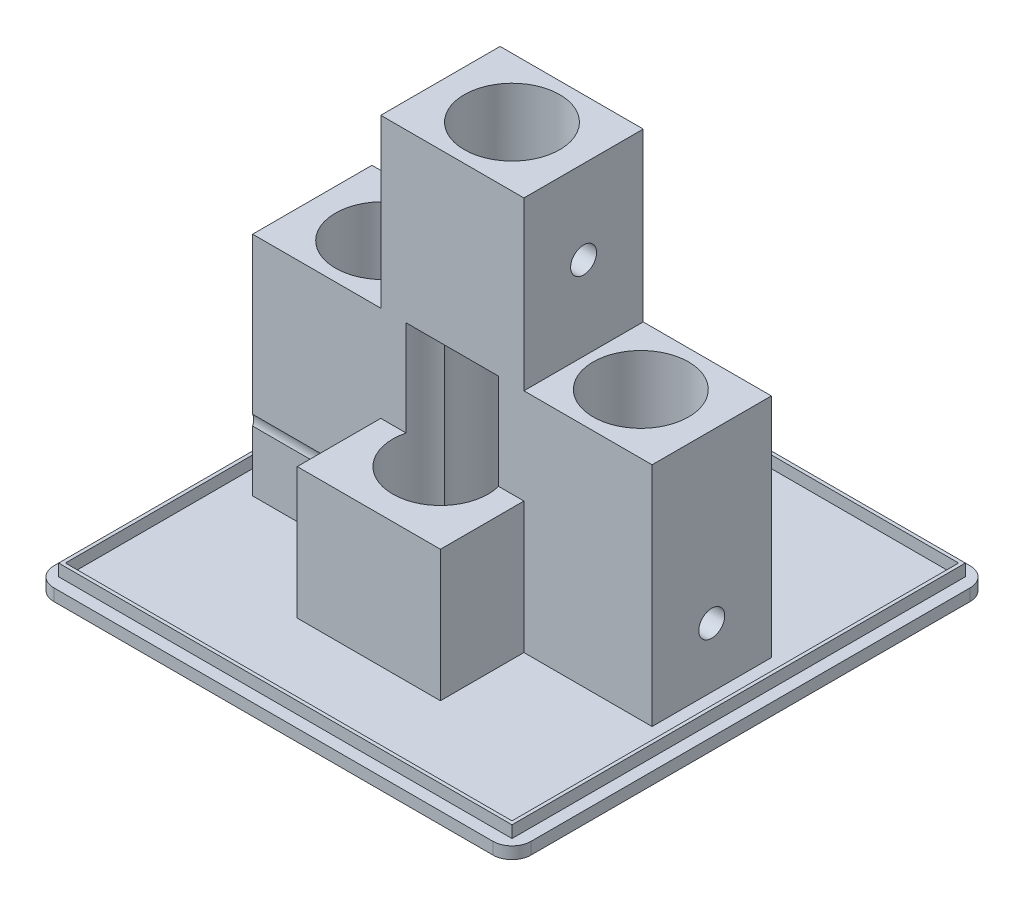
from build123d import *

# Parameters (mm, degrees)
SKETCH1_W                       = 19.05
SKETCH1_H                       = 19.05
BOSS_EXTRUDE1_DEPTH             = 38.1
SKETCH6_W                       = 19.05
SKETCH6_H                       = 15.875
BOSS_EXTRUDE3_DEPTH             = 34.925
SKETCH2_R                       = 6.35
CUT_EXTRUDE1_DEPTH              = 31.75
SKETCH8_R                       = 6.35
CUT_EXTRUDE4_DEPTH              = 67.750552432
SKETCH10_W                      = 17.05
SKETCH10_H                      = 15.875
BOSS_EXTRUDE4_DEPTH             = 31.75
SKETCH11_R                      = 6.35
CUT_EXTRUDE6_DEPTH              = 31.75
CUT_EXTRUDE7_REACH              = 70.78
CUT_EXTRUDE7_END_RADIUS         = 6.35
SKETCH12_R                      = 1.7272
SKETCH13_W                      = 63.5
SKETCH13_H                      = 63.5
BOSS_EXTRUDE5_DEPTH             = 1.5875
CUT_EXTRUDE9_REACH              = 81.121
CUT_EXTRUDE9_END_RADIUS         = 6.35
SKETCH15_R                      = 1.7272
SKETCH16_W                      = 60.325
SKETCH16_H                      = 60.325
SKETCH16_W_2                    = 59.425
SKETCH16_H_2                    = 59.425
BOSS_EXTRUDE6_DEPTH             = 1.5875
FILLET1_R                       = 2.54
CUT_EXTRUDE10_REACH             = 81.121
SKETCH18_R                      = 1.7272
CUT_EXTRUDE10_DIRECTION_2_DEPTH = 80.12059235


with BuildPart() as part:
    # Sketch1 → Boss-Extrude1 (new body)
    with BuildSketch(Plane.XY):
        Rectangle(SKETCH1_W, SKETCH1_H)
    extrude(amount=BOSS_EXTRUDE1_DEPTH)

    # Sketch6 → Boss-Extrude3 (add)
    with BuildSketch(Plane(origin=(0, 9.525, 0), x_dir=(1, 0, 0), z_dir=(0, 1, 0))):
        with Locations((0, -19.05)):
            Rectangle(SKETCH6_W, SKETCH6_H)
    extrude(amount=BOSS_EXTRUDE3_DEPTH)

    # Sketch2 → Cut-Extrude1 (cut)
    with BuildSketch(Plane(origin=(0, -9.525, 0), x_dir=(-1, 0, 0), z_dir=(0, -1, 0))):
        with Locations(Location((0, -28.575, 0), (0, 0, 90))):
            Circle(SKETCH2_R)
        with Locations(Location((0, -9.525, 0), (0, 0, 90))):
            Circle(SKETCH2_R)
    extrude(amount=-CUT_EXTRUDE1_DEPTH, mode=Mode.SUBTRACT)

    # Sketch8 → Cut-Extrude4 (cut, through all)
    with BuildSketch(Plane(origin=(0, 44.45, 0), x_dir=(1, 0, 0), z_dir=(0, 1, 0))):
        with Locations(Location((0, -19.05, 0), (0, 0, 270))):
            Circle(SKETCH8_R)
    extrude(amount=-CUT_EXTRUDE4_DEPTH, mode=Mode.SUBTRACT)

    # Sketch10 → Boss-Extrude4 (add)
    with BuildSketch(Plane(origin=(0, -9.525, 0), x_dir=(-1, 0, 0), z_dir=(0, -1, 0))):
        with Locations((-18.05, -19.05)):
            Rectangle(SKETCH10_W, SKETCH10_H)
    boss_extrude4 = extrude(amount=-BOSS_EXTRUDE4_DEPTH)

    # Sketch11 → Cut-Extrude6 (cut)
    with BuildSketch(Plane(origin=(0, -9.525, 0), x_dir=(-1, 0, 0), z_dir=(0, -1, 0))):
        with Locations(Location((-17.145, -19.05, 0), (0, 0, 90))):
            Circle(SKETCH11_R)
    cut_extrude6 = extrude(amount=-CUT_EXTRUDE6_DEPTH, mode=Mode.SUBTRACT)

    # Cut-Extrude7: up to this cylinder (the profile starts outside it)
    cut_extrude7_end = Plane(origin=(17.145, 0, 19.05), z_dir=(0, -1, 0)) * Cylinder(CUT_EXTRUDE7_END_RADIUS, 155.26, mode=Mode.PRIVATE)
    # Sketch12 → Cut-Extrude7 (cut, up to the surface)
    with BuildSketch(Plane(origin=(26.575, 0, 0), x_dir=(0, 0, -1), z_dir=(1, 0, 0)), mode=Mode.PRIVATE) as cut_extrude7_sk1:
        with Locations((-19.05, 0)):
            Circle(SKETCH12_R)
    cut_extrude7_tool1 = extrude(cut_extrude7_sk1.sketch, amount=-CUT_EXTRUDE7_REACH, mode=Mode.PRIVATE) - cut_extrude7_end
    cut_extrude7 = cut_extrude7_tool1.solids().sort_by_distance((26.575, 0, 19.05))[0]
    add(cut_extrude7, mode=Mode.SUBTRACT)

    # Mirror1: Boss-Extrude4, Cut-Extrude6, Cut-Extrude7 across plane
    add(boss_extrude4.mirror(Plane(origin=(0, 0, 0), x_dir=(0, 0, 1), z_dir=(1, 0, 0))))
    add(cut_extrude6.mirror(Plane(origin=(0, 0, 0), x_dir=(0, 0, 1), z_dir=(1, 0, 0))), mode=Mode.SUBTRACT)
    add(cut_extrude7.mirror(Plane(origin=(0, 0, 0), x_dir=(0, 0, 1), z_dir=(1, 0, 0))), mode=Mode.SUBTRACT)

    # Sketch13 → Boss-Extrude5 (add)
    with BuildSketch(Plane(origin=(0, -9.525, 0), x_dir=(-1, 0, 0), z_dir=(0, -1, 0))):
        with Locations((0, -19.05)):
            Rectangle(SKETCH13_W, SKETCH13_H)
        Polygon((9.525, -26.9875), (26.575, -26.9875), (26.575, -11.1125), (9.525, -11.1125), (9.525, 0), (-9.525, 0), (-9.525, -11.1125), (-26.575, -11.1125), (-26.575, -26.9875), (-9.525, -26.9875), (-9.525, -38.1), (9.525, -38.1), align=None, mode=Mode.SUBTRACT)
    extrude(amount=-BOSS_EXTRUDE5_DEPTH)

    # Cut-Extrude9: up to this cylinder (the profile starts outside it)
    cut_extrude9_end = Plane(origin=(0, 33.3375, 19.05), z_dir=(0, 1, 0)) * Cylinder(CUT_EXTRUDE9_END_RADIUS, 175.942, mode=Mode.PRIVATE)
    # Sketch15 → Cut-Extrude9 (cut, up to the surface)
    with BuildSketch(Plane(origin=(9.525, 0, 0), x_dir=(0, 0, -1), z_dir=(1, 0, 0)), mode=Mode.PRIVATE) as cut_extrude9_sk1:
        with Locations((-19.05, 33.3375)):
            Circle(SKETCH15_R)
    cut_extrude9_tool1 = extrude(cut_extrude9_sk1.sketch, amount=-CUT_EXTRUDE9_REACH, mode=Mode.PRIVATE) - cut_extrude9_end
    add(cut_extrude9_tool1.solids().sort_by_distance((9.525, 33.3375, 19.05))[0], mode=Mode.SUBTRACT)

    # Sketch16 → Boss-Extrude6 (add)
    with BuildSketch(Plane(origin=(0, -7.9375, 0), x_dir=(1, 0, 0), z_dir=(0, 1, 0))):
        with Locations((0, -19.05)):
            Rectangle(SKETCH16_W, SKETCH16_H)
        with Locations((0, -19.05)):
            Rectangle(SKETCH16_W_2, SKETCH16_H_2, mode=Mode.SUBTRACT)
    extrude(amount=BOSS_EXTRUDE6_DEPTH)

    # Fillet1
    fillet1_edges = [part.edges().sort_by_distance(p)[0] for p in [
        (31.75, -8.73125, 50.8),
        (31.75, -8.73125, -12.7),
        (-31.75, -8.73125, -12.7),
        (-31.75, -8.73125, 50.8),
    ]]
    fillet(fillet1_edges, radius=FILLET1_R)

    # Sketch18 → Cut-Extrude10 (cut, up to next)
    with BuildSketch(Plane.ZY.offset(9.525), mode=Mode.PRIVATE) as cut_extrude10_sk1:
        with Locations(Location((28.575, 0.79375, 0), (0, 0, 156.797426943))):
            Circle(SKETCH18_R)
    cut_extrude10_tool1 = extrude(cut_extrude10_sk1.sketch, amount=-CUT_EXTRUDE10_REACH, mode=Mode.PRIVATE) & part.part
    # Sketch18 → Cut-Extrude10 (cut, up to next)
    with BuildSketch(Plane.ZY.offset(9.525), mode=Mode.PRIVATE) as cut_extrude10_sk2:
        with Locations(Location((9.525, 0.79375, 0), (0, 0, 336.797426943))):
            Circle(SKETCH18_R)
    cut_extrude10_tool2 = extrude(cut_extrude10_sk2.sketch, amount=-CUT_EXTRUDE10_REACH, mode=Mode.PRIVATE) & part.part
    add(cut_extrude10_tool1.solids().sort_by_distance((-9.525, 0.79375, 28.575))[0], mode=Mode.SUBTRACT)
    add(cut_extrude10_tool2.solids().sort_by_distance((-9.525, 0.79375, 9.525))[0], mode=Mode.SUBTRACT)

    # Sketch18 → Cut-Extrude10 direction 2 (cut)
    with BuildSketch(Plane.ZY.offset(9.525)):
        with Locations(Location((28.575, 0.79375, 0), (0, 0, 156.797426943))):
            Circle(SKETCH18_R)
        with Locations(Location((9.525, 0.79375, 0), (0, 0, 336.797426943))):
            Circle(SKETCH18_R)
    extrude(amount=CUT_EXTRUDE10_DIRECTION_2_DEPTH, mode=Mode.SUBTRACT)


solid = part.part
